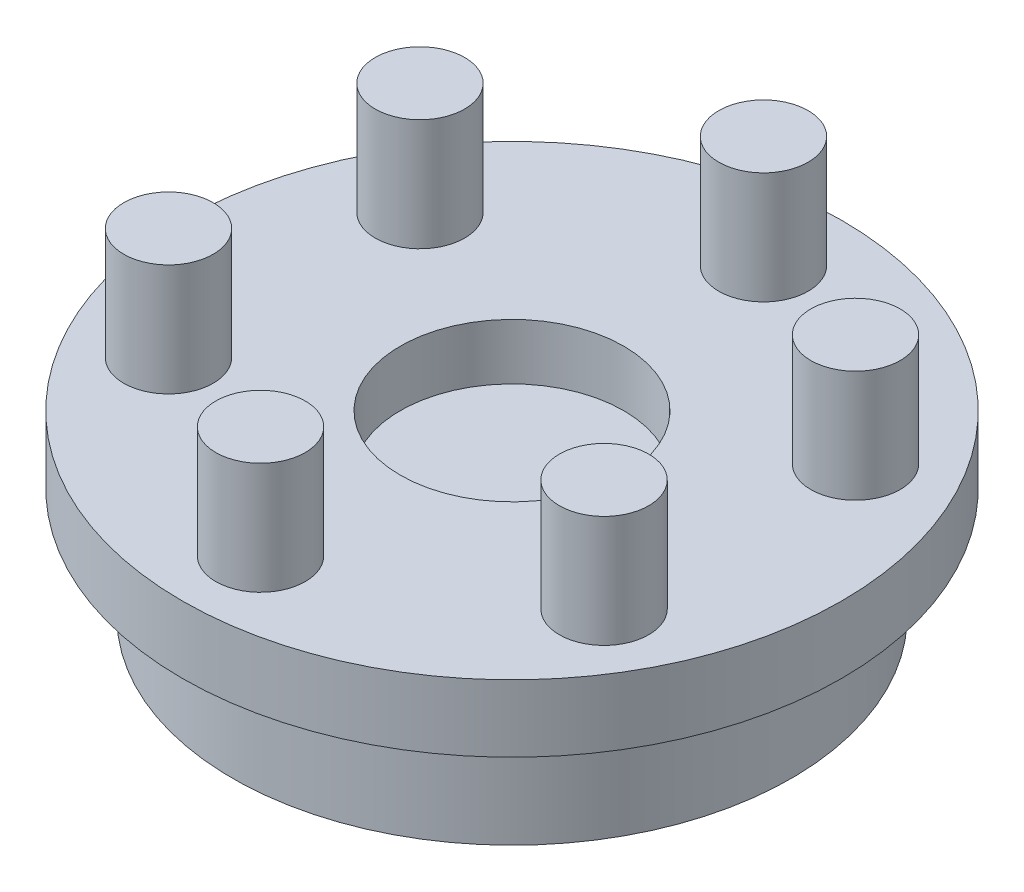
from build123d import *

# Parameters (mm, degrees)
SKETCH1_R                = 4
BOSS_EXTRUDE1_DEPTH      = 10
BOSS_EXTRUDE1_2_DEPTH    = 10
BOSS_EXTRUDE1_3_DEPTH    = 10
BOSS_EXTRUDE1_4_DEPTH    = 10
BOSS_EXTRUDE1_5_DEPTH    = 10
BOSS_EXTRUDE1_6_DEPTH    = 10
SKETCH1_4_R              = 29.5
BOSS_EXTRUDE2_DEPTH      = 6
SKETCH1_5_R              = 10
CUT_EXTRUDE1_DEPTH       = 5
SKETCH2_R                = 25
BOSS_EXTRUDE3_DEPTH      = 10
SKETCH3_R                = 15
CUT_EXTRUDE2_DEPTH       = 8
CIRPATTERN1_COUNT        = 8
CUT_EXTRUDE3_DEPTH       = 8
FILLET1_R                = 1
CIRPATTERN2_COUNT        = 8
FILLET1_OF_CIRPATTERN2_R = 1


with BuildPart() as part:
    # Sketch1 → Boss-Extrude1 (new body)
    with BuildSketch(Plane(origin=(0, 0, 0), x_dir=(1, 0, 0), z_dir=(0, 1, 0))):
        with Locations((0, 22.5)):
            Circle(SKETCH1_R)
    extrude(amount=BOSS_EXTRUDE1_DEPTH)


with BuildPart() as body_2:
    # Sketch1 → Boss-Extrude1 2 (new body)
    with BuildSketch(Plane(origin=(0, 0, 0), x_dir=(1, 0, 0), z_dir=(0, 1, 0))):
        with Locations((19.485571585, 11.25)):
            Circle(SKETCH1_R)
    extrude(amount=BOSS_EXTRUDE1_2_DEPTH)


with BuildPart() as body_3:
    # Sketch1 → Boss-Extrude1 3 (new body)
    with BuildSketch(Plane(origin=(0, 0, 0), x_dir=(1, 0, 0), z_dir=(0, 1, 0))):
        with Locations((19.485571585, -11.25)):
            Circle(SKETCH1_R)
    extrude(amount=BOSS_EXTRUDE1_3_DEPTH)


with BuildPart() as body_4:
    # Sketch1 → Boss-Extrude1 4 (new body)
    with BuildSketch(Plane(origin=(0, 0, 0), x_dir=(1, 0, 0), z_dir=(0, 1, 0))):
        with Locations((0, -22.5)):
            Circle(SKETCH1_R)
    extrude(amount=BOSS_EXTRUDE1_4_DEPTH)


with BuildPart() as body_5:
    # Sketch1 → Boss-Extrude1 5 (new body)
    with BuildSketch(Plane(origin=(0, 0, 0), x_dir=(1, 0, 0), z_dir=(0, 1, 0))):
        with Locations((-19.485571585, -11.25)):
            Circle(SKETCH1_R)
    extrude(amount=BOSS_EXTRUDE1_5_DEPTH)


with BuildPart() as body_6:
    # Sketch1 → Boss-Extrude1 6 (new body)
    with BuildSketch(Plane(origin=(0, 0, 0), x_dir=(1, 0, 0), z_dir=(0, 1, 0))):
        with Locations((-19.485571585, 11.25)):
            Circle(SKETCH1_R)
    extrude(amount=BOSS_EXTRUDE1_6_DEPTH)


with BuildPart() as body_7:
    # Sketch1<4> → Boss-Extrude2 (new body)
    with BuildSketch(Plane(origin=(0, 0, 0), x_dir=(1, 0, 0), z_dir=(0, 1, 0))):
        Circle(SKETCH1_4_R)
    extrude(amount=-BOSS_EXTRUDE2_DEPTH)

    # Sketch1<5> → Cut-Extrude1 (cut)
    with BuildSketch(Plane(origin=(0, 0, 0), x_dir=(1, 0, 0), z_dir=(0, 1, 0))):
        Circle(SKETCH1_5_R)
    extrude(amount=-CUT_EXTRUDE1_DEPTH, mode=Mode.SUBTRACT)

    # Sketch2 → Boss-Extrude3 (add)
    with BuildSketch(Plane.XZ.offset(6)):
        Circle(SKETCH2_R)
    extrude(amount=BOSS_EXTRUDE3_DEPTH)

    # Sketch3 → Cut-Extrude2 (cut)
    with BuildSketch(Plane.XZ.offset(16)):
        Circle(SKETCH3_R)
    extrude(amount=-CUT_EXTRUDE2_DEPTH, mode=Mode.SUBTRACT)

    # Sketch6 → M5 Tapped Hole1 (revolve, cut)
    with BuildSketch(Plane(origin=(0, -16, 20), x_dir=(0, 0, -1), z_dir=(1, 0, 0))):
        Polygon((0, 0), (0, 9.2618073), (2.1, 8), (2.1, 0.425), (2.525, 0), align=None)
    m5_tapped_hole1 = revolve(axis=Axis((0, -22.35, 20), (0, 1, 0)), mode=Mode.SUBTRACT)

    # CirPattern1: M5 Tapped Hole1 ×8 about axis
    cirpattern1_axis = Axis((0, -16, 0), (0, -1, 0))
    for i in range(1, CIRPATTERN1_COUNT):
        add(m5_tapped_hole1.rotate(cirpattern1_axis, i * 360 / CIRPATTERN1_COUNT), mode=Mode.SUBTRACT)

    # Sketch7 → Cut-Extrude3 (cut)
    with BuildSketch(Plane.XZ.offset(16)):
        with BuildLine():
            ThreePointArc((-22.712013708, -3.622237796), (-21.248348999, -8.801354334), (-18.621127816, -13.498509998))
            ThreePointArc((-18.621127816, -13.498509998), (-17.057957436, -10.68184544), (-14.017040855, -9.618865092))
            ThreePointArc((-14.017040855, -9.618865092), (-15.705952053, -6.50561835), (-16.713109375, -3.109979907))
            ThreePointArc((-16.713109375, -3.109979907), (-19.615002722, -4.50859203), (-22.712013708, -3.622237796))
        make_face()
    cut_extrude3 = extrude(amount=-CUT_EXTRUDE3_DEPTH, mode=Mode.SUBTRACT)

    # Fillet1
    fillet1_edges = [body_7.edges().sort_by_distance(p)[0] for p in [
        (-22.712013708, -12, -3.622237796),
        (-18.621127816, -12, -13.498509998),
        (-14.017040855, -12, -9.618865092),
        (-16.713109375, -12, -3.109979907),
    ]]
    fillet(fillet1_edges, radius=FILLET1_R)

    # CirPattern2: Cut-Extrude3 ×8 about axis
    cirpattern2_axis = Axis((0, -16, 0), (0, -1, 0))
    for i in range(1, CIRPATTERN2_COUNT):
        add(cut_extrude3.rotate(cirpattern2_axis, i * 360 / CIRPATTERN2_COUNT), mode=Mode.SUBTRACT)

    # Fillet1 of CirPattern2
    fillet1_of_cirpattern2_edges = [body_7.edges().sort_by_distance(p)[0] for p in [
        (-13.498509998, -12, -18.621127816),
        (-3.622237796, -12, -22.712013708),
        (-3.109979907, -12, -16.713109375),
        (-9.618865092, -12, -14.017040855),
        (3.622237796, -12, -22.712013708),
        (13.498509998, -12, -18.621127816),
        (9.618865092, -12, -14.017040855),
        (3.109979907, -12, -16.713109375),
        (18.621127816, -12, -13.498509998),
        (22.712013708, -12, -3.622237796),
        (16.713109375, -12, -3.109979907),
        (14.017040855, -12, -9.618865092),
        (22.712013708, -12, 3.622237796),
        (18.621127816, -12, 13.498509998),
        (14.017040855, -12, 9.618865092),
        (16.713109375, -12, 3.109979907),
        (13.498509998, -12, 18.621127816),
        (3.622237796, -12, 22.712013708),
        (3.109979907, -12, 16.713109375),
        (9.618865092, -12, 14.017040855),
        (-3.622237796, -12, 22.712013708),
        (-13.498509998, -12, 18.621127816),
        (-9.618865092, -12, 14.017040855),
        (-3.109979907, -12, 16.713109375),
        (-18.621127816, -12, 13.498509998),
        (-22.712013708, -12, 3.622237796),
        (-16.713109375, -12, 3.109979907),
        (-14.017040855, -12, 9.618865092),
    ]]
    fillet(fillet1_of_cirpattern2_edges, radius=FILLET1_OF_CIRPATTERN2_R)


solid = Compound([part.part, body_2.part, body_3.part, body_4.part, body_5.part, body_6.part, body_7.part])
